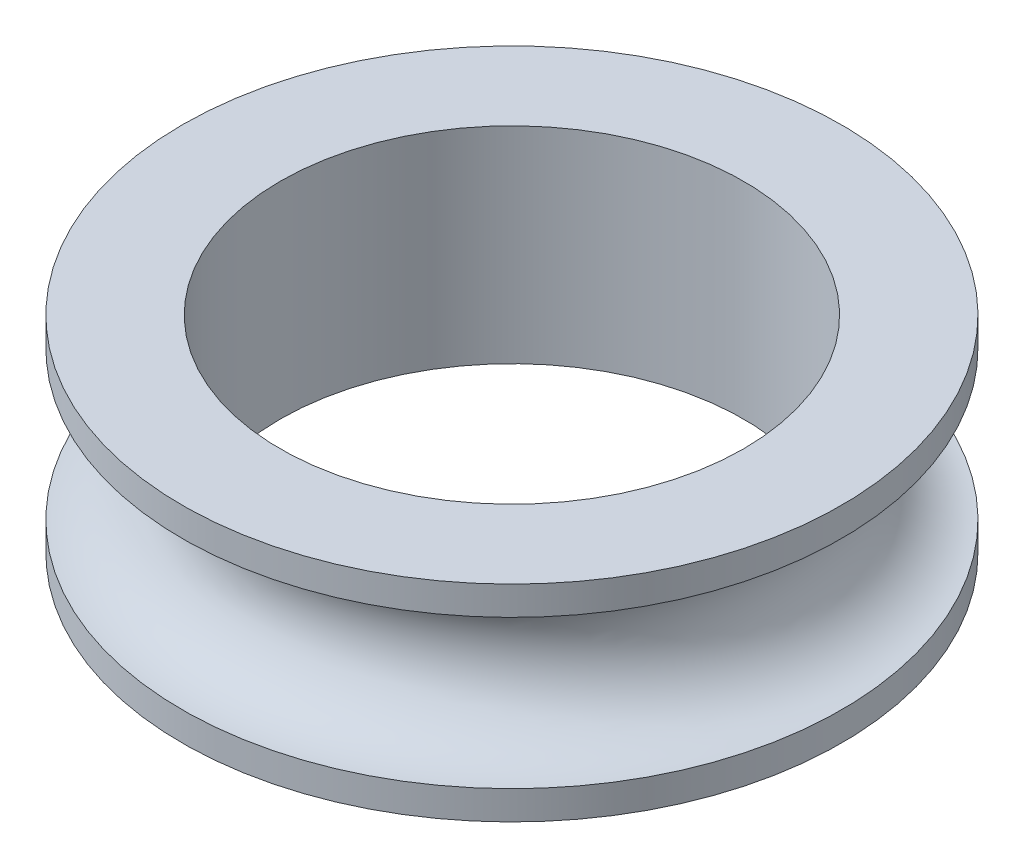
from build123d import *

# Parameters (mm, degrees)
SKETCH2_R          = 5.625
CUT_EXTRUDE1_DEPTH = 13.369316877


with BuildPart() as part:
    # Sketch1 → Revolve1 (revolve)
    with BuildSketch(Plane.XY):
        with BuildLine():
            Line((-8, -1.8), (-8, -2.5))
            Line((-8, -2.5), (0, -2.5))
            Line((0, -2.5), (0, 2.5))
            Line((0, 2.5), (-8, 2.5))
            Line((-8, 2.5), (-8, 1.8))
            ThreePointArc((-8, 1.8), (-6.2, 0), (-8, -1.8))
        make_face()
    revolve(axis=Axis((0, 2.5, 0), (0, -1, 0)))

    # Sketch2 → Cut-Extrude1 (cut, through all)
    with BuildSketch(Plane(origin=(0, 2.5, 0), x_dir=(1, 0, 0), z_dir=(0, 1, 0))):
        Circle(SKETCH2_R)
    extrude(amount=-CUT_EXTRUDE1_DEPTH, mode=Mode.SUBTRACT)


solid = part.part
